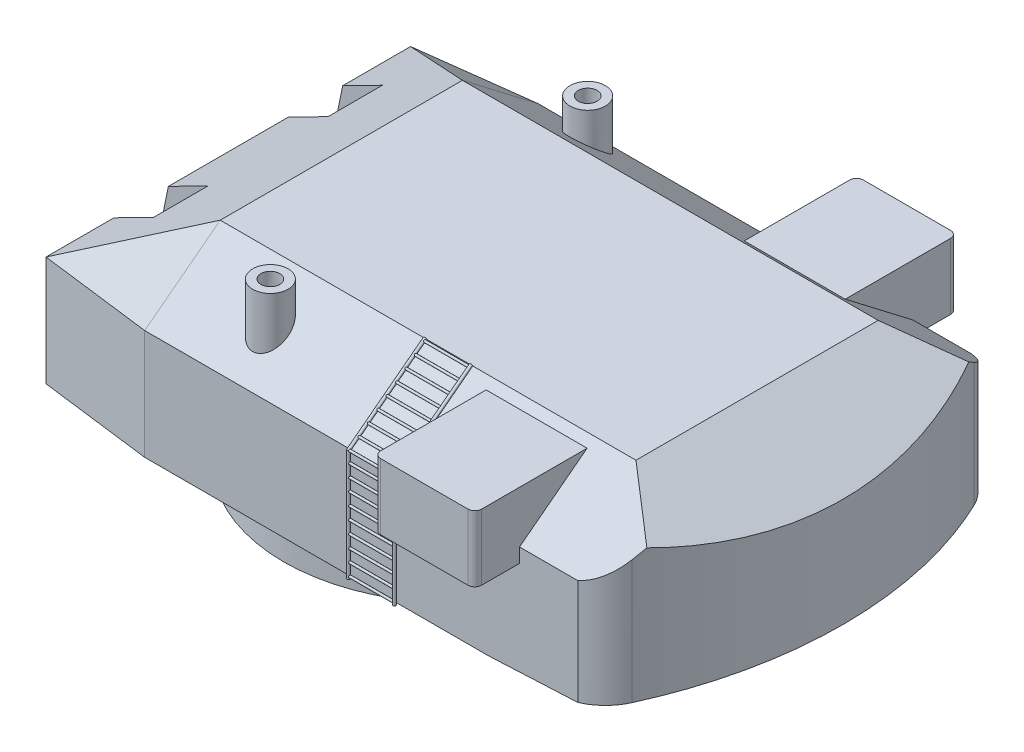
from build123d import *

# Parameters (mm, degrees)
BOSS_EXTRUDE1_DEPTH             = 3646.94
CUT_EXTRUDE1_DEPTH              = 80746.286308706
CUT_EXTRUDE1_DEPTH_BACK         = 80746.286308706
CUT_EXTRUDE2_DEPTH              = 80746.286308706
CUT_EXTRUDE2_DEPTH_BACK         = 80746.286308706
CUT_EXTRUDE3_DEPTH              = 80746.286308706
CUT_EXTRUDE3_DEPTH_BACK         = 80746.286308706
CUT_EXTRUDE4_DEPTH              = 12273.894604734
CUT_EXTRUDE4_DEPTH_BACK         = 12273.894604734
CUT_EXTRUDE7_DEPTH              = 15887.542554187
CUT_EXTRUDE8_START              = 800
SKETCH12_W                      = 2427.156261862
SKETCH12_H                      = 1183.48234603
CUT_EXTRUDE8_DEPTH              = 2032
SKETCH13_R                      = 65.57064834
CUT_EXTRUDE9_DEPTH              = 3000
BOSS_EXTRUDE2_DEPTH             = 5250
FILLET1_R                       = 150
SKETCH16_R                      = 3725
BOSS_EXTRUDE3_DEPTH             = 1010.000000066
SKETCH15_R                      = 385.342953163
SKETCH15_R_2                    = 205.342953163
BOSS_EXTRUDE4_DEPTH             = 254
BOSS_EXTRUDE4_DIRECTION_2_REACH = 80856.539
SWEEP1_PROFILE_R                = 31.75
SWEEP2_PROFILE_R                = 31.75
BOSS_EXTRUDE6_REACH             = 9911.227
BOSS_EXTRUDE6_END_RADIUS        = 31.75
SKETCH69_R                      = 25.4
LPATTERN3_COUNT                 = 9
LPATTERN3_PITCH                 = 256.54
BOSS_EXTRUDE7_REACH             = 10682.859
BOSS_EXTRUDE7_END_RADIUS        = 31.75
SKETCH83_R                      = 25.4
LPATTERN4_COUNT                 = 12
LPATTERN4_PITCH                 = 266.7
CUT_EXTRUDE10_DEPTH             = 10681.858780125
CUT_EXTRUDE10_DEPTH_BACK        = 10681.858780125
SKETCH84_W                      = 676.822962352
SKETCH84_H                      = 890.021010423


with BuildPart() as part:
    # Sketch1 → Boss-Extrude1 (new body)
    with BuildSketch(Plane(origin=(0, 0, 0), x_dir=(1, 0, 0), z_dir=(0, 1, 0))):
        with BuildLine():
            Line((-77605.419943701, -4277.169505984), (-68184.66250219, -4277.169505984))
            ThreePointArc((-68184.66250219, -4277.169505984), (-67818.633220115, -4061.190578365), (-67561.230024443, -3723.007303542))
            ThreePointArc((-67561.230024443, -3723.007303542), (-66695.351583128, 0), (-67561.230024443, 3723.007303542))
            ThreePointArc((-67561.230024443, 3723.007303542), (-67818.633220115, 4061.190578365), (-68184.66250219, 4277.169505984))
            Line((-68184.66250219, 4277.169505984), (-77605.419943701, 4277.169505984))
            Line((-77605.419943701, 4277.169505984), (-80064.514717037, 3965.45326711))
            ThreePointArc((-80064.514717037, 3965.45326711), (-80426.722932468, 2901.0602648), (-80549.406644174, 1783.439594996))
            Line((-80549.406644174, 1783.439594996), (-80549.406644174, -1783.439594996))
            ThreePointArc((-80549.406644174, -1783.439594996), (-80426.722932468, -2901.0602648), (-80064.514717037, -3965.45326711))
            Line((-80064.514717037, -3965.45326711), (-77605.419943701, -4277.169505984))
        make_face()
    extrude(amount=BOSS_EXTRUDE1_DEPTH)

    # Sketch3 → Cut-Extrude1 (cut, two sides: drawn at the far end of the back side and taken through both)
    with BuildSketch(Plane.XY.offset(-CUT_EXTRUDE1_DEPTH_BACK)):
        Polygon((-77605.419943701, 3646.94), (-80064.514717037, 2388.907960843), (-80549.406644174, 0), (-80549.406644174, 3646.94), align=None)
    extrude(amount=CUT_EXTRUDE1_DEPTH + CUT_EXTRUDE1_DEPTH_BACK, mode=Mode.SUBTRACT)

    # Sketch4 → Cut-Extrude2 (cut, two sides: drawn at the far end of the back side and taken through both)
    with BuildSketch(Plane.XY.offset(-CUT_EXTRUDE2_DEPTH_BACK)):
        Polygon((-68560.959457012, 3646.94), (-66695.351583128, 2524.735132285), (-66695.351583128, 3646.94), align=None)
    extrude(amount=CUT_EXTRUDE2_DEPTH + CUT_EXTRUDE2_DEPTH_BACK, mode=Mode.SUBTRACT)

    # Sketch6 → Cut-Extrude3 (cut, two sides: drawn at the far end of the back side and taken through both)
    with BuildSketch(Plane.XY.offset(-CUT_EXTRUDE3_DEPTH_BACK)):
        Polygon((-70130.854002597, 0), (-66695.351583128, 164.081159468), (-66695.351583128, 0), align=None)
    extrude(amount=CUT_EXTRUDE3_DEPTH + CUT_EXTRUDE3_DEPTH_BACK, mode=Mode.SUBTRACT)

    # Sketch8 → Cut-Extrude4 (cut, two sides: drawn at the far end of the back side and taken through both)
    with BuildSketch(Plane.ZY.offset(77605.419943701).offset(-CUT_EXTRUDE4_DEPTH_BACK)):
        Polygon((-4277.169505984, 3646.94), (-4277.169505984, 2388.907960843), (-2634.483274211, 3646.94), align=None)
        Polygon((2634.483274211, 3646.94), (4277.169505984, 2388.907960843), (4277.169505984, 3646.94), align=None)
    extrude(amount=CUT_EXTRUDE4_DEPTH + CUT_EXTRUDE4_DEPTH_BACK, mode=Mode.SUBTRACT)

    # 3DSketch2 → Cut-Extrude7 (cut, through all)
    with BuildSketch(Plane(origin=(-80064.514717037, 2388.907960843, 3965.45326711), x_dir=(0.8020139796459529, 0.41029703010495355, -0.4340851570135934), z_dir=(0.07684471257893655, -0.7915762314150632, -0.6062193992337982))):
        Polygon((0, 0), (3066.149513281, 0), (1836.916992994, 1664.34674232), align=None)
    cut_extrude7 = extrude(amount=-CUT_EXTRUDE7_DEPTH, mode=Mode.SUBTRACT)

    # Mirror2: Cut-Extrude7 across plane
    add(cut_extrude7.mirror(Plane.XY), mode=Mode.SUBTRACT)

    # Sketch12 → Cut-Extrude8 (cut)
    with BuildSketch(Plane(origin=(0, 0, 0), x_dir=(1, 0, 0), z_dir=(0, 1, 0)).offset(CUT_EXTRUDE8_START)):
        with Locations((-79335.828513243, -1896.123812228)):
            Rectangle(SKETCH12_W, SKETCH12_H)
    cut_extrude8 = extrude(amount=CUT_EXTRUDE8_DEPTH, mode=Mode.SUBTRACT)

    # Mirror3: Cut-Extrude8 across plane
    add(cut_extrude8.mirror(Plane.XY), mode=Mode.SUBTRACT)

    # Sketch13 → Cut-Extrude9 (cut, symmetric)
    with BuildSketch(Plane.XY):
        with Locations((-79846.413589942, 1633.478101155)):
            Circle(SKETCH13_R)
    extrude(amount=CUT_EXTRUDE9_DEPTH, both=True, mode=Mode.SUBTRACT)

    # Sketch14 → Boss-Extrude2 (add, symmetric)
    with BuildSketch(Plane.XY):
        Polygon((-71648.014620305, 2388.907960843), (-71648.014620305, 3514.507297713), (-69451.461981903, 3514.507297713), (-69451.461981903, 2388.907960843), (-69451.461981903, 2079.997883159), (-71648.014620305, 2079.997883159), align=None)
    extrude(amount=BOSS_EXTRUDE2_DEPTH, both=True)

    # Fillet1
    fillet1_edges = [part.edges().sort_by_distance(p)[0] for p in [
        (-69451.461981903, 2797.252590436, -5250),
        (-71648.014620305, 2797.252590436, -5250),
        (-71648.014620305, 2797.252590436, 5250),
        (-69451.461981903, 2797.252590436, 5250),
    ]]
    fillet(fillet1_edges, radius=FILLET1_R)

    # Sketch16 → Boss-Extrude3 (add)
    with BuildSketch(Plane.XZ):
        with Locations(Location((-75132.17606115, 0, 0), (0, 0, 270))):
            Circle(SKETCH16_R)
    extrude(amount=BOSS_EXTRUDE3_DEPTH)

    # Sketch15 → Boss-Extrude4 (add)
    with BuildSketch(Plane(origin=(0, 3646.94, 0), x_dir=(1, 0, 0), z_dir=(0, 1, 0))):
        with Locations(Location((-75697.39762586, 3451.286334507, 0), (0, 0, 270))):
            Circle(SKETCH15_R)
        with Locations(Location((-75697.39762586, 3451.286334507, 0), (0, 0, 270))):
            Circle(SKETCH15_R_2, mode=Mode.SUBTRACT)
    boss_extrude4 = extrude(amount=BOSS_EXTRUDE4_DEPTH)

    # Sketch15 → Boss-Extrude4 direction 2 (add, up to next)
    with BuildSketch(Plane(origin=(0, 3646.94, 0), x_dir=(1, 0, 0), z_dir=(0, 1, 0)), mode=Mode.PRIVATE) as boss_extrude4_direction_2_sk1:
        with Locations(Location((-75697.39762586, 3451.286334507, 0), (0, 0, 270))):
            Circle(SKETCH15_R)
        with Locations(Location((-75697.39762586, 3451.286334507, 0), (0, 0, 270))):
            Circle(SKETCH15_R_2, mode=Mode.SUBTRACT)
    boss_extrude4_direction_2_tool1 = extrude(boss_extrude4_direction_2_sk1.sketch, amount=-BOSS_EXTRUDE4_DIRECTION_2_REACH, mode=Mode.PRIVATE) - part.part
    boss_extrude4_direction_2 = boss_extrude4_direction_2_tool1.solids().sort_by_distance((-75697.397626, 3646.94, -3825.730143))[0]
    add(boss_extrude4_direction_2)

    # Mirror4: Boss-Extrude4, Boss-Extrude4 direction 2 across plane
    add(boss_extrude4.mirror(Plane.XY))
    add(boss_extrude4_direction_2.mirror(Plane.XY))


with BuildPart() as body_2:
    # Sweep1: sweep along a path in Sketch19
    with BuildLine(Plane.ZY.offset(73105.419943719)) as sweep1_path:
        Line((4340.669505984, -789.552828028), (4340.669505984, 2420.259714878))
        Line((4340.669505984, 2420.259714878), (2673.092370327, 3697.354161672))
    # Sweep1 profile (on start of the path) → Sweep1 (sweep)
    with BuildSketch(Plane(origin=(-73105.419943719, -789.552828028, 4340.669505984), x_dir=(0, 0, 1), z_dir=(0, 1, 0))):
        Circle(SWEEP1_PROFILE_R)
    sweep(path=sweep1_path.line, transition=Transition.RIGHT)



with BuildPart() as body_3:
    # Sweep2: sweep along a path in Sketch56
    with BuildLine(Plane.ZY.offset(72105.419943723)) as sweep2_path:
        Line((2673.092370327, 3697.354161672), (4340.669505984, 2420.259714878))
        Line((4340.669505984, 2420.259714878), (4340.669505984, -789.552828028))
    # Sweep2 profile (on start of the path) → Sweep2 (sweep)
    with BuildSketch(Plane(origin=(-72105.419943723, 3697.354161672, 2673.092370327), x_dir=(0, 0.7939238058613676, 0.6080172616682864), z_dir=(0, -0.6080172616682864, 0.7939238058613676))):
        Circle(SWEEP2_PROFILE_R)
    sweep(path=sweep2_path.line, transition=Transition.RIGHT)


with BuildPart() as body_2_1:
    add(body_2.part)

    add(body_3.part)  # Boss-Extrude6 merges body 3
    # Boss-Extrude6: up to this cylinder (the profile starts outside it)
    boss_extrude6_end = Plane(origin=(-72105.419943723, 3669.370102305, 2709.632798234), z_dir=(0, -0.6080172616682866, 0.7939238058613675)) * Cylinder(BOSS_EXTRUDE6_END_RADIUS, 19886.954, mode=Mode.PRIVATE)
    # Sketch69 → Boss-Extrude6 (add, up to the surface)
    with BuildSketch(Plane.ZY.offset(73105.419943719), mode=Mode.PRIVATE) as boss_extrude6_sk1:
        with Locations((2709.632798273, 3669.370102275)):
            Circle(SKETCH69_R)
    boss_extrude6_tool1 = extrude(boss_extrude6_sk1.sketch, amount=-BOSS_EXTRUDE6_REACH, mode=Mode.PRIVATE) - boss_extrude6_end
    boss_extrude6 = boss_extrude6_tool1.solids().sort_by_distance((-73105.419944, 3669.370102, 2709.632798))[0]
    add(boss_extrude6)

    # LPattern3: Boss-Extrude6 ×9
    with Locations(*[Vector(0, -0.6080172616682872, 0.7939238058613671) * (i * LPATTERN3_PITCH) for i in range(1, LPATTERN3_COUNT)]):
        add(boss_extrude6)

    # Boss-Extrude7: up to this cylinder (the profile starts outside it)
    boss_extrude7_end = Plane(origin=(-73105.419943719, -747.164898, 4340.669505984), z_dir=(0, -1, 0)) * Cylinder(BOSS_EXTRUDE7_END_RADIUS, 21430.218, mode=Mode.PRIVATE)
    # Sketch83 → Boss-Extrude7 (add, up to the surface)
    with BuildSketch(Plane.ZY.offset(72105.419943723), mode=Mode.PRIVATE) as boss_extrude7_sk1:
        with Locations(Location((4340.669505984, -747.164897618, 0), (0, 0, 180))):
            Circle(SKETCH83_R)
    boss_extrude7_tool1 = extrude(boss_extrude7_sk1.sketch, amount=BOSS_EXTRUDE7_REACH, mode=Mode.PRIVATE) - boss_extrude7_end
    boss_extrude7 = boss_extrude7_tool1.solids().sort_by_distance((-72105.419944, -747.164898, 4340.669506))[0]
    add(boss_extrude7)

    # LPattern4: Boss-Extrude7 ×12
    with Locations(*[(0, i * LPATTERN4_PITCH, 0) for i in range(1, LPATTERN4_COUNT)]):
        add(boss_extrude7)

    # Sketch84 → Cut-Extrude10 (cut, two sides: drawn at the far end of the back side and taken through both)
    with BuildSketch(Plane.ZY.offset(72105.419943723).offset(-CUT_EXTRUDE10_DEPTH_BACK)):
        with Locations((4297.084810965, -445.010505212)):
            Rectangle(SKETCH84_W, SKETCH84_H)
    extrude(amount=CUT_EXTRUDE10_DEPTH + CUT_EXTRUDE10_DEPTH_BACK, mode=Mode.SUBTRACT)


solid = Compound([part.part, body_2_1.part])
